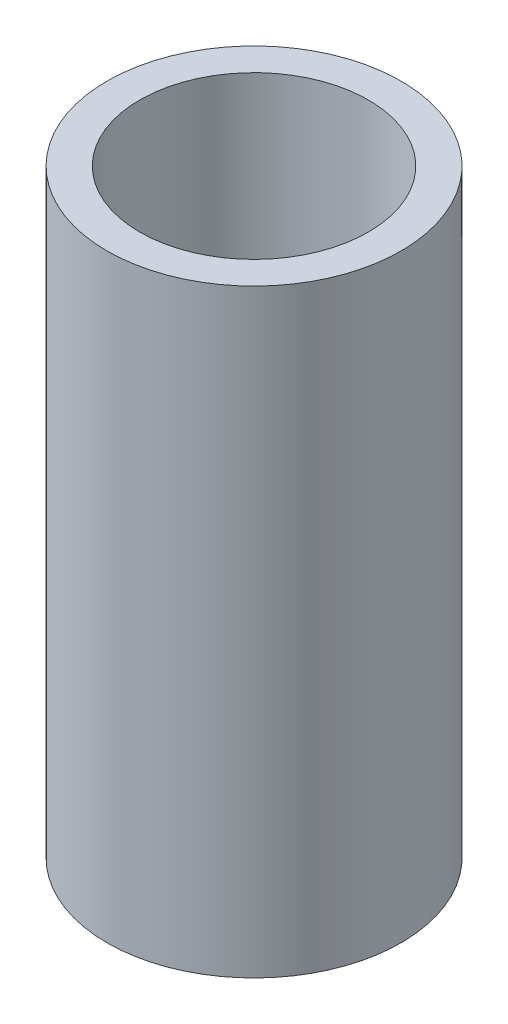
from build123d import *

# Parameters (mm, degrees)
SKETCH1_R           = 3.429
SKETCH1_R_2         = 2.667
BOSS_EXTRUDE1_DEPTH = 13.97


with BuildPart() as part:
    # Sketch1 → Boss-Extrude1 (new body)
    with BuildSketch(Plane(origin=(0, 0, 0), x_dir=(1, 0, 0), z_dir=(0, 1, 0))):
        with Locations(Location((0, 0, 0), (0, 0, 270))):
            Circle(SKETCH1_R)
        with Locations(Location((0, 0, 0), (0, 0, 270))):
            Circle(SKETCH1_R_2, mode=Mode.SUBTRACT)
    extrude(amount=BOSS_EXTRUDE1_DEPTH)


solid = part.part
